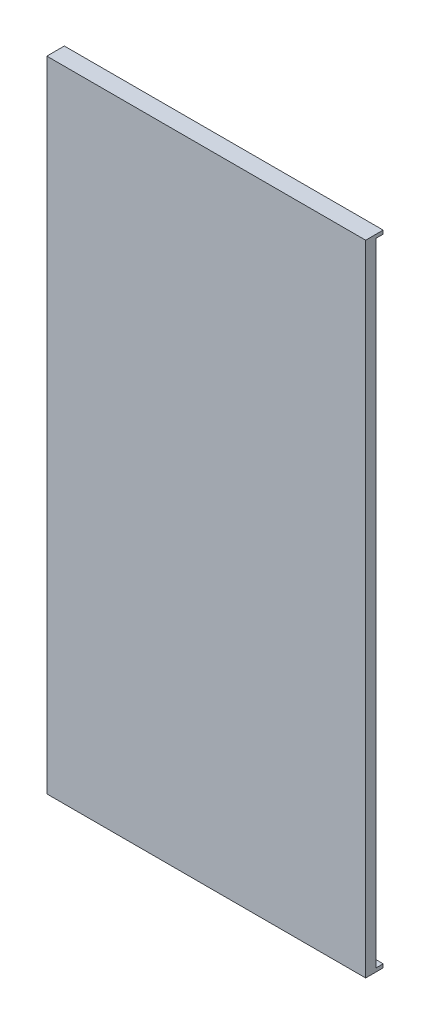
from build123d import *

# Parameters (mm, degrees)
SZKIC1_W                    = 224.5
SZKIC1_H                    = 449.9
DODANIE_WYCI_GNI_CIE1_DEPTH = 12.33
SZKIC2_W                    = 219.5
SZKIC2_H                    = 444.9
WYTNIJ_WYCI_GNI_CIE1_DEPTH  = 10
SZKIC4_W                    = 2.5
SZKIC4_H                    = 444.9
WYTNIJ_WYCI_GNI_CIE3_DEPTH  = 5


with BuildPart() as part:
    # Szkic1 → Dodanie-wyciągnięcie1 (new body)
    with BuildSketch(Plane.XY):
        with Locations((112.25, 224.95)):
            Rectangle(SZKIC1_W, SZKIC1_H)
    extrude(amount=DODANIE_WYCI_GNI_CIE1_DEPTH)

    # Szkic2 → Wytnij-wyciągnięcie1 (cut)
    with BuildSketch(Plane(origin=(0, 0, 0), x_dir=(-1, 0, 0), z_dir=(0, 0, -1))):
        with Locations((-112.25, 224.95)):
            Rectangle(SZKIC2_W, SZKIC2_H)
    extrude(amount=-WYTNIJ_WYCI_GNI_CIE1_DEPTH, mode=Mode.SUBTRACT)

    # Szkic4 → Wytnij-wyciągnięcie3 (cut)
    with BuildSketch(Plane(origin=(0, 0, 0), x_dir=(-1, 0, 0), z_dir=(0, 0, -1))):
        with Locations((-223.25, 224.95)):
            Rectangle(SZKIC4_W, SZKIC4_H)
    extrude(amount=-WYTNIJ_WYCI_GNI_CIE3_DEPTH, mode=Mode.SUBTRACT)


solid = part.part
